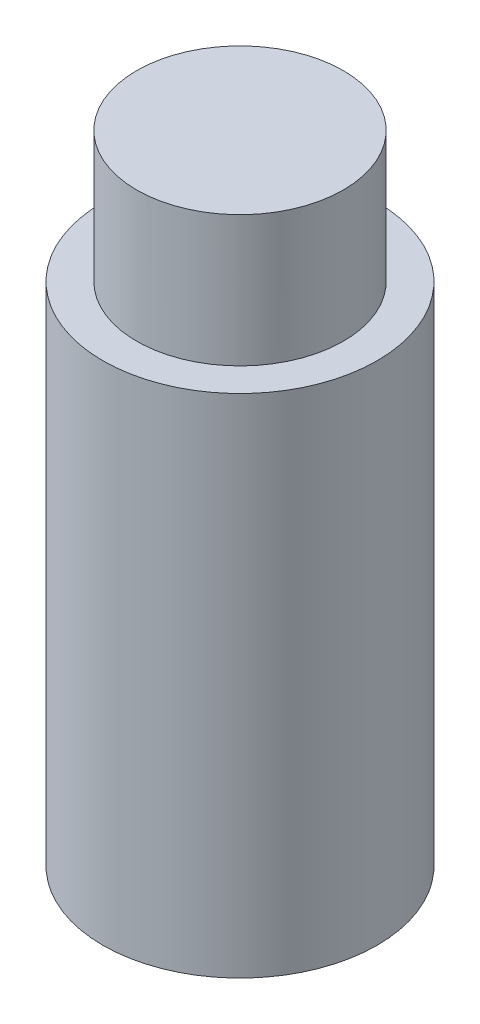
from build123d import *

# Parameters (mm, degrees)
SKETCH_1_R      = 2.92
EXTRUDE_1_DEPTH = 18
SKETCH_2_R      = 3.874230649
EXTRUDE_3_DEPTH = 14.3


with BuildPart() as part:
    # 草圖1 → 填料-伸長1 (new body)
    with BuildSketch(Plane(origin=(0, 0, 0), x_dir=(1, 0, 0), z_dir=(0, 1, 0))):
        with Locations(Location((0, 0, 0), (0, 0, 270))):
            Circle(SKETCH_1_R)
    extrude(amount=EXTRUDE_1_DEPTH)

    # 草圖2 → 填料-伸長3 (add)
    with BuildSketch(Plane.XZ):
        with Locations(Location((0, 0, 0), (0, 0, 270))):
            Circle(SKETCH_2_R)
    extrude(amount=-EXTRUDE_3_DEPTH)


solid = part.part
